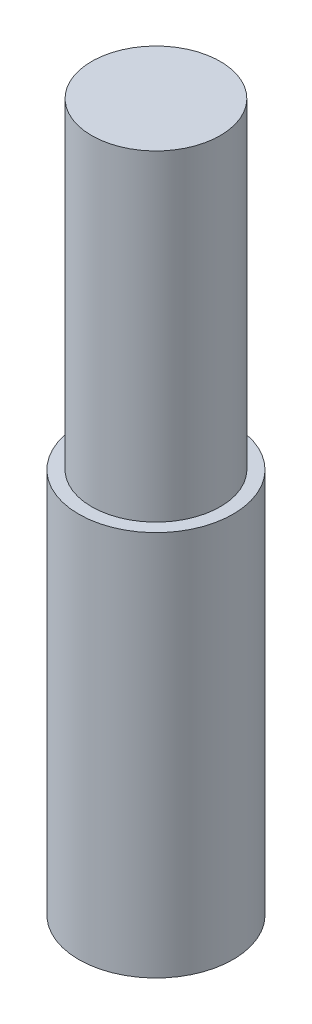
from build123d import *

# Parameters (mm, degrees)
SKETCH1_R           = 12
BOSS_EXTRUDE1_DEPTH = 60
SKETCH2_R           = 10
BOSS_EXTRUDE2_DEPTH = 50


with BuildPart() as part:
    # Sketch1 → Boss-Extrude1 (new body)
    with BuildSketch(Plane(origin=(0, 0, 0), x_dir=(1, 0, 0), z_dir=(0, 1, 0))):
        with Locations(Location((0, 0, 0), (0, 0, 270))):
            Circle(SKETCH1_R)
    extrude(amount=BOSS_EXTRUDE1_DEPTH)

    # Sketch2 → Boss-Extrude2 (add)
    with BuildSketch(Plane(origin=(0, 60, 0), x_dir=(1, 0, 0), z_dir=(0, 1, 0))):
        with Locations(Location((0, 0, 0), (0, 0, 270))):
            Circle(SKETCH2_R)
    extrude(amount=BOSS_EXTRUDE2_DEPTH)


solid = part.part
